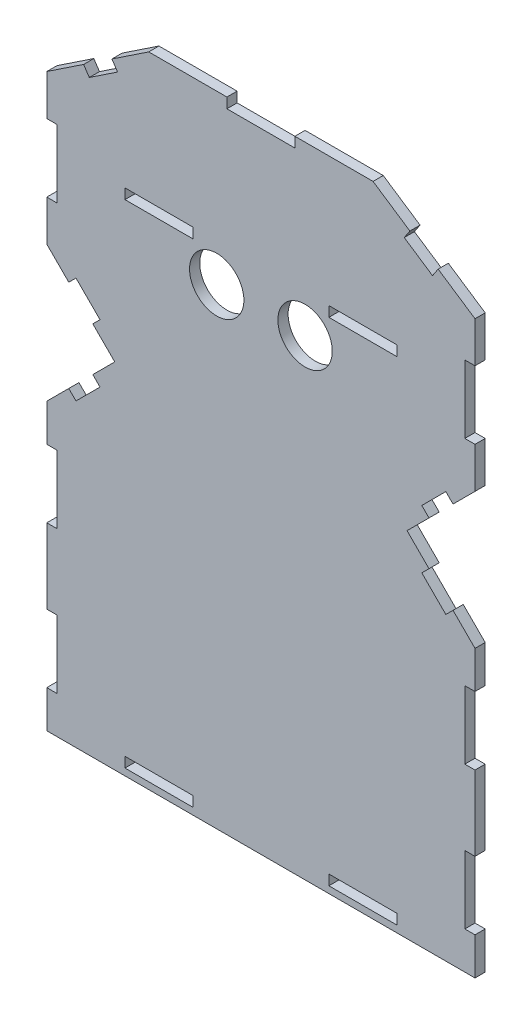
from build123d import *

# Parameters (mm, degrees)
SKETCH1_R           = 8
SKETCH1_W           = 20
SKETCH1_H           = 3
BOSS_EXTRUDE1_DEPTH = 3


with BuildPart() as part:
    # Sketch1 → Boss-Extrude1 (new body)
    with BuildSketch(Plane.XY):
        Polygon((62.274694919, 0), (62.274694919, -11), (59.274694919, -11), (59.274694919, -31), (62.274694919, -31), (62.274694919, -53), (59.274694919, -53), (59.274694919, -73), (62.274694919, -73), (62.274694919, -84), (-63.725305081, -84), (-63.725305081, -73), (-60.725305081, -73), (-60.725305081, -53), (-63.725305081, -53), (-63.725305081, -31), (-60.725305081, -31), (-60.725305081, -11), (-63.725305081, -11), (-63.725305081, 0), (-57.260838987, 6.464466094), (-55.139518643, 4.343145751), (-48.068450831, 11.414213562), (-50.189771175, 13.535533906), (-43.725305081, 20), (-50.189771175, 26.464466094), (-48.068450831, 28.585786438), (-55.139518643, 35.656854249), (-57.260838987, 33.535533906), (-63.725305081, 40), (-63.725305081, 52), (-60.725305081, 52), (-60.725305081, 72), (-63.725305081, 72), (-63.725305081, 84), (-52.885556553, 91.226499019), (-51.221455964, 88.730348136), (-42.90095302, 94.277350098), (-44.565053609, 96.773500981), (-33.725305081, 104), (-10.725305081, 104), (-10.725305081, 101), (9.274694919, 101), (9.274694919, 104), (32.274694919, 104), (43.114443447, 96.773500981), (41.450342859, 94.277350098), (49.770845802, 88.730348136), (51.434946391, 91.226499019), (62.274694919, 84), (62.274694919, 72), (59.274694919, 72), (59.274694919, 52), (62.274694919, 52), (62.274694919, 40), (55.810228825, 33.535533906), (53.688908482, 35.656854249), (46.61784067, 28.585786438), (48.739161013, 26.464466094), (42.274694919, 20), (48.739161013, 13.535533906), (46.61784067, 11.414213562), (53.688908482, 4.343145751), (55.810228825, 6.464466094), align=None)
        with Locations((-13.725305081, 54.688830471)):
            Circle(SKETCH1_R, mode=Mode.SUBTRACT)
        with Locations(Location((12.274694919, 54.688830471, 0), (0, 0, 180))):
            Circle(SKETCH1_R, mode=Mode.SUBTRACT)
        with Locations((29.274694919, -80.5)):
            Rectangle(SKETCH1_W, SKETCH1_H, mode=Mode.SUBTRACT)
        with Locations((-30.725305081, -80.5)):
            Rectangle(SKETCH1_W, SKETCH1_H, mode=Mode.SUBTRACT)
        with Locations((29.274694919, 64.35252343)):
            Rectangle(SKETCH1_W, SKETCH1_H, mode=Mode.SUBTRACT)
        with Locations((-30.725305081, 64.35252343)):
            Rectangle(SKETCH1_W, SKETCH1_H, mode=Mode.SUBTRACT)
    extrude(amount=BOSS_EXTRUDE1_DEPTH)


solid = part.part
